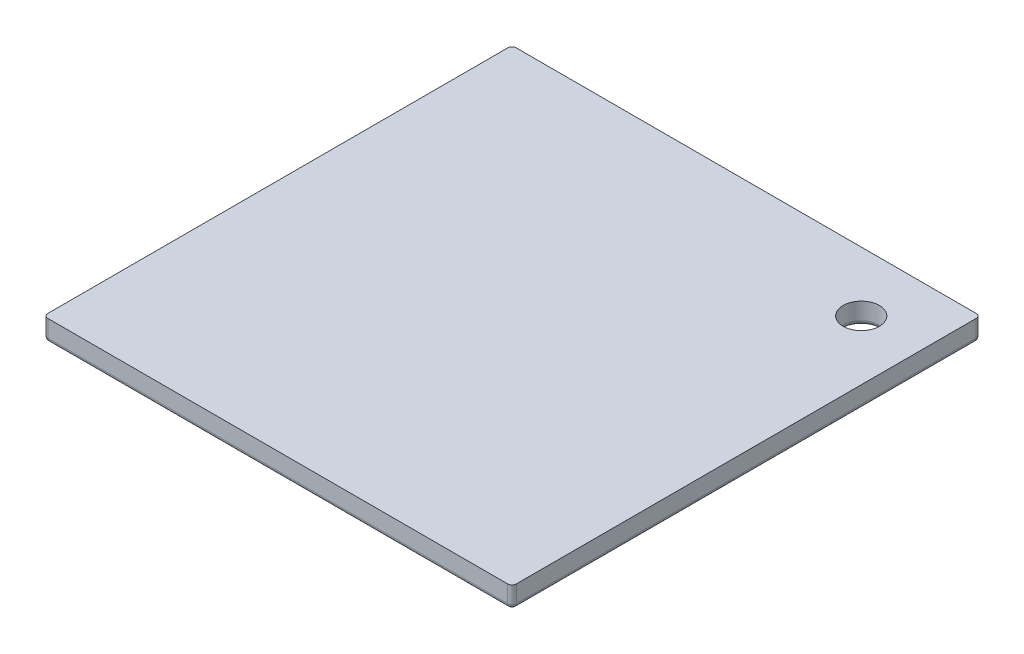
from build123d import *

# Parameters (mm, degrees)
SKETCH1_W           = 220
SKETCH1_H           = 220
SKETCH1_W_2         = 194
SKETCH1_H_2         = 194
SKETCH1_R           = 8.5
BOSS_EXTRUDE1_DEPTH = 10
FILLET1_R           = 2
FILLET2_R           = 2


with BuildPart() as part:
    # Sketch1 → Boss-Extrude1 (new body)
    # profile 1 of 2: a face of its own
    with BuildSketch(Plane(origin=(0, 0, 0), x_dir=(1, 0, 0), z_dir=(0, 1, 0))):
        Rectangle(SKETCH1_W, SKETCH1_H)
        Rectangle(SKETCH1_W_2, SKETCH1_H_2, mode=Mode.SUBTRACT)
    # profile 2 of 2: a face of its own
    with BuildSketch(Plane(origin=(0, 0, 0), x_dir=(1, 0, 0), z_dir=(0, 1, 0))):
        Rectangle(SKETCH1_W_2, SKETCH1_H_2)
        with Locations(Location((82, 82, 0), (0, 0, 270))):
            Circle(SKETCH1_R, mode=Mode.SUBTRACT)
    extrude(amount=BOSS_EXTRUDE1_DEPTH)

    # Fillet1
    fillet1_edges = [part.edges().sort_by_distance(p)[0] for p in [
        (110, 5, 110),
        (-110, 5, 110),
        (-110, 5, -110),
        (110, 5, -110),
    ]]
    fillet(fillet1_edges, radius=FILLET1_R)

    # Fillet2
    fillet2_edges = [part.edges().sort_by_distance(p)[0] for p in [
        (0, 0, 110),
        (110, 0, 0),
        (-110, 0, 0),
        (0, 0, -110),
        (109.414213562, 0, 109.414213562),
        (109.414213562, 0, -109.414213562),
        (-109.414213562, 0, -109.414213562),
        (-109.414213562, 0, 109.414213562),
        (82, 0, -90.5),
    ]]
    fillet(fillet2_edges, radius=FILLET2_R)


solid = part.part
